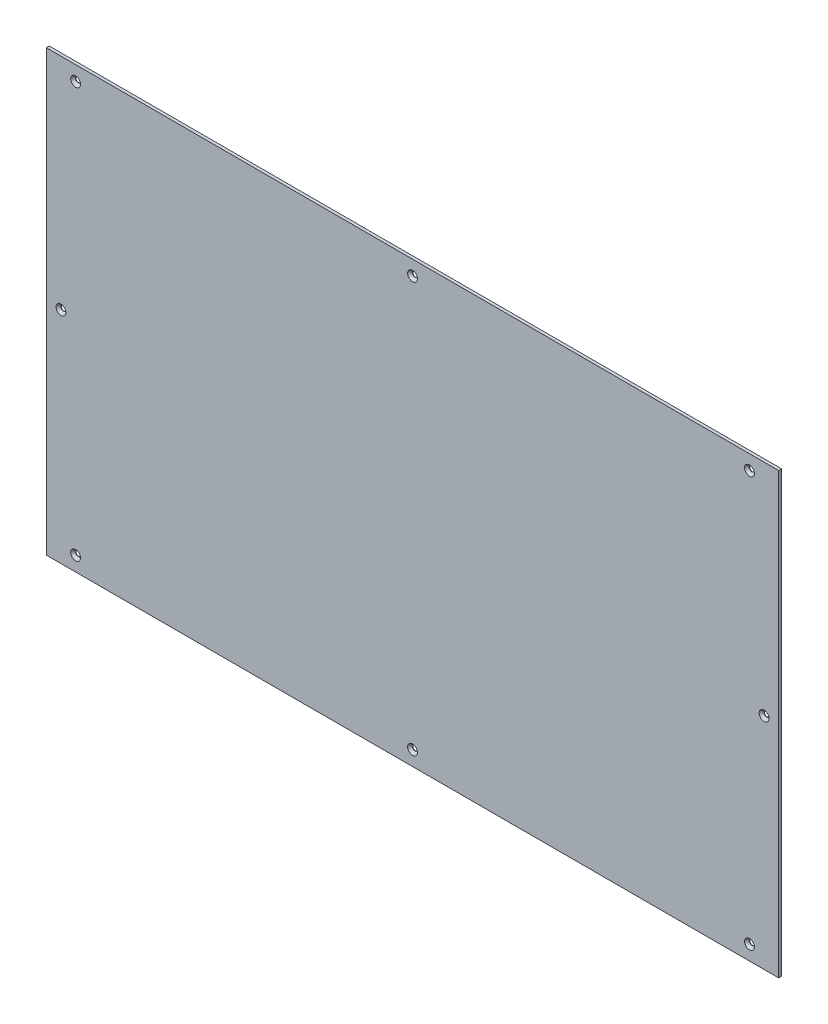
from build123d import *

# Parameters (mm, degrees)
SKETCH1_W                                    = 1000
SKETCH1_H                                    = 600
BOSS_EXTRUDE1_DEPTH                          = 4
CSK_FOR_M6_HEX_SOCKET_COUNTERSUNK_CA_2_COUNT = 2
CSK_FOR_M6_HEX_SOCKET_COUNTERSUNK_CA_2_PITCH = 960
CSK_FOR_M6_HEX_SOCKET_COUNTERSUNK_CA_3_COUNT = 2
CSK_FOR_M6_HEX_SOCKET_COUNTERSUNK_CA_3_PITCH = 280.713376952
CSK_FOR_M6_HEX_SOCKET_COUNTERSUNK_CA_4_COUNT = 2
CSK_FOR_M6_HEX_SOCKET_COUNTERSUNK_CA_4_PITCH = 555.697759578
CSK_FOR_M6_HEX_SOCKET_COUNTERSUNK_CA_5_COUNT = 2
CSK_FOR_M6_HEX_SOCKET_COUNTERSUNK_CA_5_PITCH = 980.815986819
CSK_FOR_M6_HEX_SOCKET_COUNTERSUNK_CA_6_COUNT = 2
CSK_FOR_M6_HEX_SOCKET_COUNTERSUNK_CA_6_PITCH = 980.815986819
CSK_FOR_M6_HEX_SOCKET_COUNTERSUNK_CA_7_COUNT = 2
CSK_FOR_M6_HEX_SOCKET_COUNTERSUNK_CA_7_PITCH = 555.697759578
CSK_FOR_M6_HEX_SOCKET_COUNTERSUNK_CA_8_COUNT = 2
CSK_FOR_M6_HEX_SOCKET_COUNTERSUNK_CA_8_PITCH = 280.713376952


with BuildPart() as part:
    # Sketch1 → Boss-Extrude1 (new body)
    with BuildSketch(Plane.XY):
        Rectangle(SKETCH1_W, SKETCH1_H)
    extrude(amount=BOSS_EXTRUDE1_DEPTH)

    # Sketch4 → CSK for M6 Hex Socket Countersunk Cap Screw1 (revolve, cut)
    with BuildSketch(Plane(origin=(-480, 0, 4), x_dir=(0, -1, 0), z_dir=(1, 0, 0))):
        Polygon((0, 0), (0, 4), (3.3, 4), (3.3, 3.42), (6.72, 0), align=None)
    csk_for_m6_hex_socket_countersunk_cap_sc = revolve(axis=Axis((-480, 0, 10.35), (0, 0, -1)), mode=Mode.SUBTRACT)

    # CSK for M6 Hex Socket Countersunk Ca 2: CSK for M6 Hex Socket Countersunk Cap Screw1 ×2
    with Locations(*[(i * CSK_FOR_M6_HEX_SOCKET_COUNTERSUNK_CA_2_PITCH, 0, 0) for i in range(1, CSK_FOR_M6_HEX_SOCKET_COUNTERSUNK_CA_2_COUNT)]):
        add(csk_for_m6_hex_socket_countersunk_cap_sc, mode=Mode.SUBTRACT)

    # CSK for M6 Hex Socket Countersunk Ca 3: CSK for M6 Hex Socket Countersunk Cap Screw1 ×2
    with Locations(*[Vector(0.07124704998790965, -0.997458699830735, 0) * (i * CSK_FOR_M6_HEX_SOCKET_COUNTERSUNK_CA_3_PITCH) for i in range(1, CSK_FOR_M6_HEX_SOCKET_COUNTERSUNK_CA_3_COUNT)]):
        add(csk_for_m6_hex_socket_countersunk_cap_sc, mode=Mode.SUBTRACT)

    # CSK for M6 Hex Socket Countersunk Ca 4: CSK for M6 Hex Socket Countersunk Cap Screw1 ×2
    with Locations(*[Vector(0.8637789008984335, -0.5038710255240862, 0) * (i * CSK_FOR_M6_HEX_SOCKET_COUNTERSUNK_CA_4_PITCH) for i in range(1, CSK_FOR_M6_HEX_SOCKET_COUNTERSUNK_CA_4_COUNT)]):
        add(csk_for_m6_hex_socket_countersunk_cap_sc, mode=Mode.SUBTRACT)

    # CSK for M6 Hex Socket Countersunk Ca 5: CSK for M6 Hex Socket Countersunk Cap Screw1 ×2
    with Locations(*[Vector(0.9583856835862682, -0.285476586600165, 0) * (i * CSK_FOR_M6_HEX_SOCKET_COUNTERSUNK_CA_5_PITCH) for i in range(1, CSK_FOR_M6_HEX_SOCKET_COUNTERSUNK_CA_5_COUNT)]):
        add(csk_for_m6_hex_socket_countersunk_cap_sc, mode=Mode.SUBTRACT)

    # CSK for M6 Hex Socket Countersunk Ca 6: CSK for M6 Hex Socket Countersunk Cap Screw1 ×2
    with Locations(*[Vector(0.9583856835862682, 0.285476586600165, 0) * (i * CSK_FOR_M6_HEX_SOCKET_COUNTERSUNK_CA_6_PITCH) for i in range(1, CSK_FOR_M6_HEX_SOCKET_COUNTERSUNK_CA_6_COUNT)]):
        add(csk_for_m6_hex_socket_countersunk_cap_sc, mode=Mode.SUBTRACT)

    # CSK for M6 Hex Socket Countersunk Ca 7: CSK for M6 Hex Socket Countersunk Cap Screw1 ×2
    with Locations(*[Vector(0.8637789008984335, 0.5038710255240862, 0) * (i * CSK_FOR_M6_HEX_SOCKET_COUNTERSUNK_CA_7_PITCH) for i in range(1, CSK_FOR_M6_HEX_SOCKET_COUNTERSUNK_CA_7_COUNT)]):
        add(csk_for_m6_hex_socket_countersunk_cap_sc, mode=Mode.SUBTRACT)

    # CSK for M6 Hex Socket Countersunk Ca 8: CSK for M6 Hex Socket Countersunk Cap Screw1 ×2
    with Locations(*[Vector(0.07124704998790965, 0.997458699830735, 0) * (i * CSK_FOR_M6_HEX_SOCKET_COUNTERSUNK_CA_8_PITCH) for i in range(1, CSK_FOR_M6_HEX_SOCKET_COUNTERSUNK_CA_8_COUNT)]):
        add(csk_for_m6_hex_socket_countersunk_cap_sc, mode=Mode.SUBTRACT)


solid = part.part
